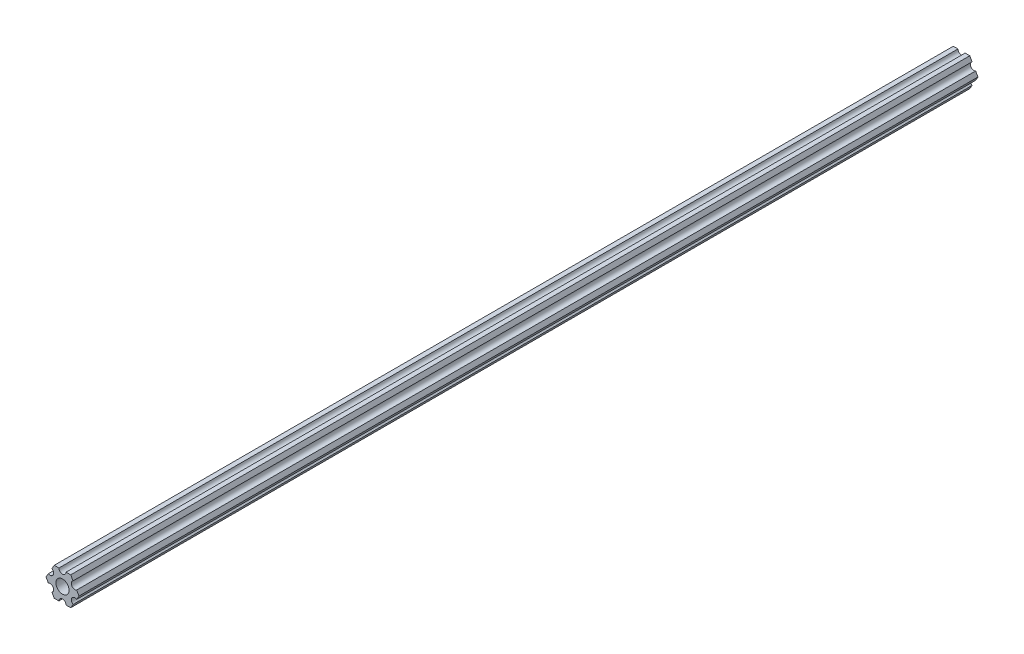
from build123d import *

# Parameters (mm, degrees)
SKETCH1_R           = 2.9337
BOSS_EXTRUDE1_DEPTH = 400.05


with BuildPart() as part:
    # Sketch1 → Boss-Extrude1 (new body)
    with BuildSketch(Plane.XY):
        with BuildLine():
            Line((-1.587500385, 6.349999904), (-3.666174594, 6.349999778))
            Line((-3.666174594, 6.349999778), (-4.70551159, 4.549815043))
            ThreePointArc((-4.70551159, 4.549815043), (-4.12444613, 2.38124975), (-6.293011423, 1.80018429))
            Line((-6.293011423, 1.80018429), (-7.332348419, -4.44e-07))
            Line((-7.332348419, -4.44e-07), (-6.293011205, -1.800185053))
            ThreePointArc((-6.293011205, -1.800185053), (-4.124445841, -2.38125025), (-4.705511038, -4.549815614))
            Line((-4.705511038, -4.549815614), (-3.666173825, -6.350000222))
            Line((-3.666173825, -6.350000222), (-1.587499615, -6.350000096))
            ThreePointArc((-1.587499615, -6.350000096), (2.89e-07, -4.7625), (1.587500385, -6.349999904))
            Line((1.587500385, -6.349999904), (3.666174594, -6.349999778))
            Line((3.666174594, -6.349999778), (4.70551159, -4.549815043))
            ThreePointArc((4.70551159, -4.549815043), (4.12444613, -2.38124975), (6.293011423, -1.80018429))
            Line((6.293011423, -1.80018429), (7.332348419, 4.44e-07))
            Line((7.332348419, 4.44e-07), (6.293011205, 1.800185053))
            ThreePointArc((6.293011205, 1.800185053), (4.124445841, 2.38125025), (4.705511038, 4.549815614))
            Line((4.705511038, 4.549815614), (3.666173825, 6.350000222))
            Line((3.666173825, 6.350000222), (1.587499615, 6.350000096))
            ThreePointArc((1.587499615, 6.350000096), (-2.89e-07, 4.7625), (-1.587500385, 6.349999904))
        make_face()
        with Locations(Location((0, 0, 0), (0, 0, 180))):
            Circle(SKETCH1_R, mode=Mode.SUBTRACT)
    extrude(amount=BOSS_EXTRUDE1_DEPTH)


solid = part.part
